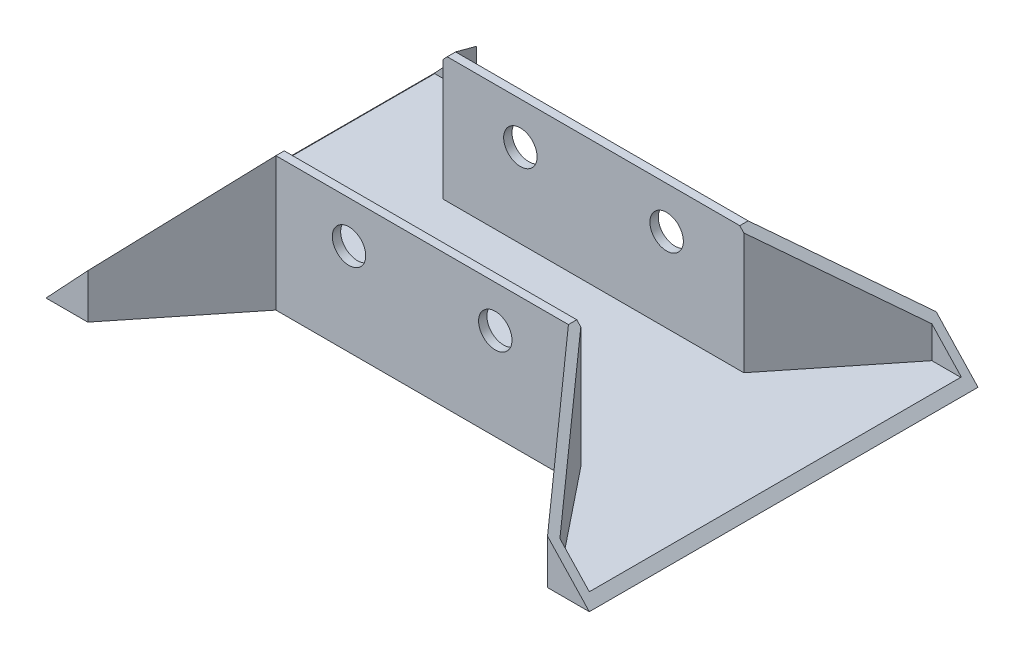
from build123d import *

# Parameters (mm, degrees)
EXTRUDE_1_DEPTH     = 46.5
CUT_EXTRUDE_1_DEPTH = 87.088617134
CUT_EXTRUDE_2_DEPTH = 30
SKETCH_4_R          = 4
CUT_EXTRUDE_3_DEPTH = 100.36297097


with BuildPart() as part:
    # ｽｹｯﾁ1 → ﾎﾞｽ - 押し出し1 (new, symmetric)
    with BuildSketch(Plane.XY):
        Polygon((-65, 0), (65, 0), (35, 32), (-35, 32), align=None)
    extrude(amount=EXTRUDE_1_DEPTH, both=True)

    # ｽｹｯﾁ2 → ｶｯﾄ - 押し出し1 (cut, through all)
    with BuildSketch(Plane(origin=(0, 32, 0), x_dir=(1, 0, 0), z_dir=(0, 1, 0))):
        Polygon((-55, -46.5), (-35, -21.5), (35, -21.5), (55, -46.5), align=None)
        Polygon((-55, 46.5), (-35, 21.5), (35, 21.5), (55, 46.5), align=None)
    extrude(amount=-CUT_EXTRUDE_1_DEPTH, mode=Mode.SUBTRACT)

    # ｽｹｯﾁ3 → ｶｯﾄ - 押し出し2 (cut)
    with BuildSketch(Plane(origin=(0, 32, 0), x_dir=(1, 0, 0), z_dir=(0, 1, 0))):
        Polygon((-35.961249695, -19.5), (35.961249695, -19.5), (55.961249695, -44.5), (63, -44.5), (63, 44.5), (55.961249695, 44.5), (35.961249695, 19.5), (-35.961249695, 19.5), (-55.961249695, 44.5), (-63, 44.5), (-63, -44.5), (-55.961249695, -44.5), align=None)
    extrude(amount=-CUT_EXTRUDE_2_DEPTH, mode=Mode.SUBTRACT)

    # ｽｹｯﾁ4 → ｶｯﾄ - 押し出し3 (cut, through all)
    with BuildSketch(Plane.XY.offset(21.5)):
        with Locations((-17.5, 22)):
            Circle(SKETCH_4_R)
        with Locations((17.5, 22)):
            Circle(SKETCH_4_R)
    extrude(amount=-CUT_EXTRUDE_3_DEPTH, mode=Mode.SUBTRACT)


solid = part.part
